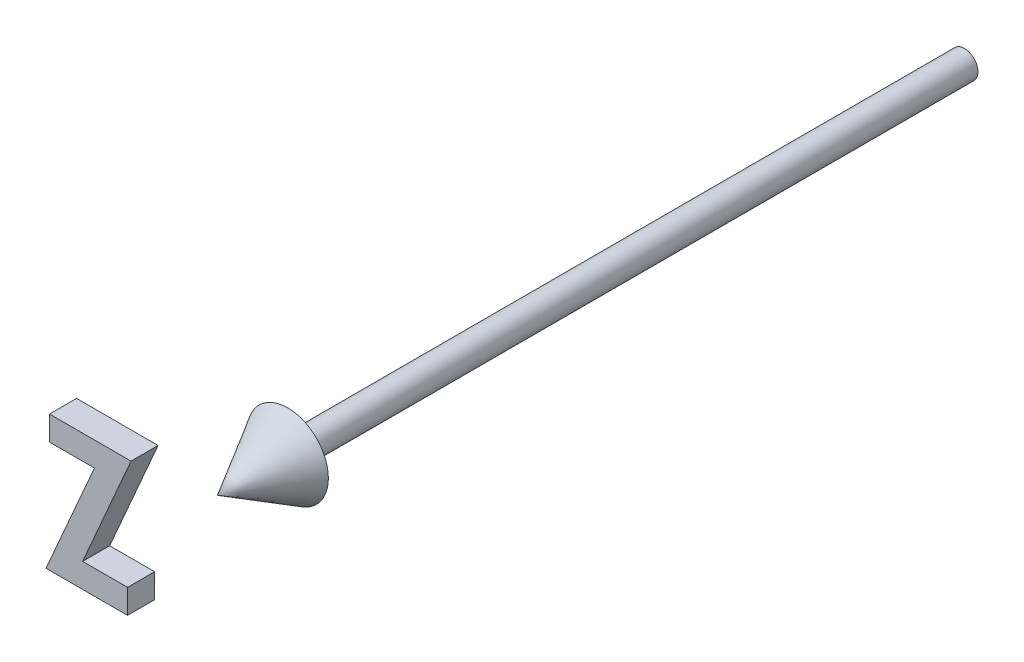
from build123d import *

# Parameters (mm, degrees)
SKETCH1_R           = 1
BOSS_EXTRUDE1_DEPTH = 50
BOSS_EXTRUDE2_DEPTH = 1


with BuildPart() as part:
    # Sketch1 → Boss-Extrude1 (new body)
    with BuildSketch(Plane.XY):
        Circle(SKETCH1_R)
    extrude(amount=BOSS_EXTRUDE1_DEPTH)

    # Sketch2 → Revolve1 (revolve)
    with BuildSketch(Plane(origin=(0, 0, 0), x_dir=(1, 0, 0), z_dir=(0, 1, 0))):
        Polygon((0, -50), (-3, -50), (0, -55.196152423), align=None)
    revolve(axis=Axis((0, 0, 55.196152423), (0, 0, -1)))


with BuildPart() as body_2:
    # Sketch4 → Boss-Extrude2 (new, symmetric)
    with BuildSketch(Plane.XY.offset(55.196152423)):
        Polygon((-5.641025641, -10), (-11.666666667, -10), (-8.086939103, -1.794871795), (-11.41025641, -1.794871795), (-11.41025641, 0), (-5.384615385, 0), (-8.962339744, -8.205128205), (-5.641025641, -8.205128205), align=None)
    extrude(amount=BOSS_EXTRUDE2_DEPTH, both=True)


solid = Compound([part.part, body_2.part])
